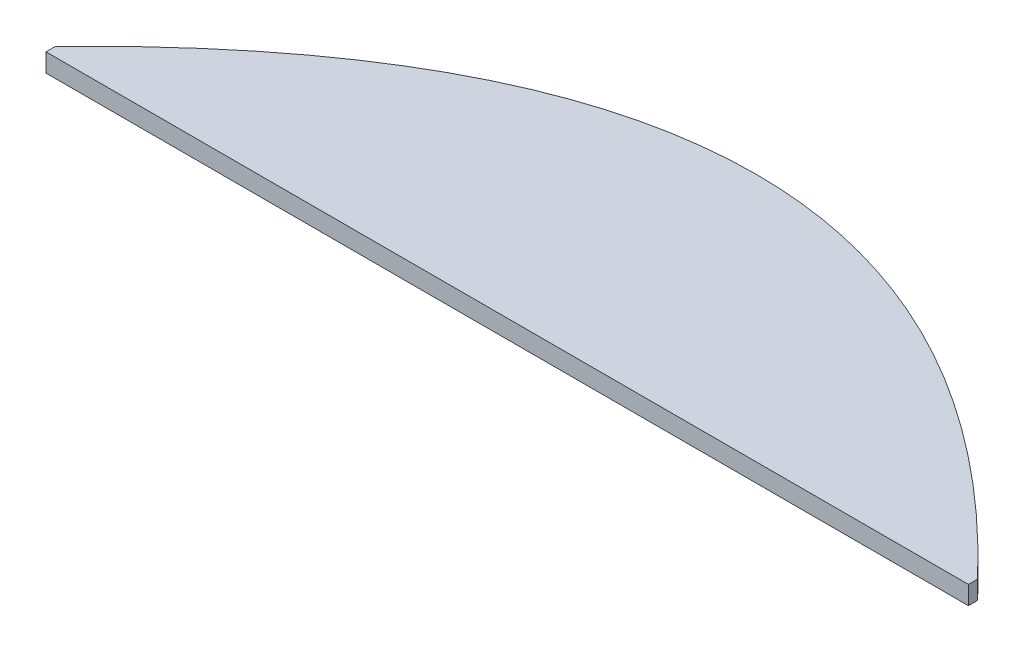
from build123d import *

# Parameters (mm, degrees)
EXTRUDE_3_DEPTH = 5
EXTRUDE_4_DEPTH = 5
SKETCH_4_W      = 500
SKETCH_4_H      = 10
EXTRUDE_5_DEPTH = 5


with BuildPart() as part:
    # 草图1 → 凸台-拉伸3 (new body)
    with BuildSketch(Plane(origin=(0, 0, 0), x_dir=(1, 0, 0), z_dir=(0, 1, 0))):
        with BuildLine():
            Line((0, 0), (-250, 0))
            add(Edge.make_bspline(
                [(-250, 0), (0, 260), (250, 0)],
                knots=[0, 0, 0, 1, 1, 1], degree=2))
            Line((250, 0), (0, 0))
        make_face()
    extrude(amount=EXTRUDE_3_DEPTH)

    # 草图3 → 凸台-拉伸4 (add)
    with BuildSketch(Plane.XZ):
        with BuildLine():
            Line((-250, 0), (250, 0))
            add(Edge.make_bspline(
                [(-250, 0), (-1e-09, -260), (250, 0)],
                knots=[0, 0, 0, 1, 1, 1], degree=2))
        make_face()
    extrude(amount=EXTRUDE_4_DEPTH)

    # 草图4 → 凸台-拉伸5 (add)
    with BuildSketch(Plane.XY):
        Rectangle(SKETCH_4_W, SKETCH_4_H)
    extrude(amount=EXTRUDE_5_DEPTH)


solid = part.part
